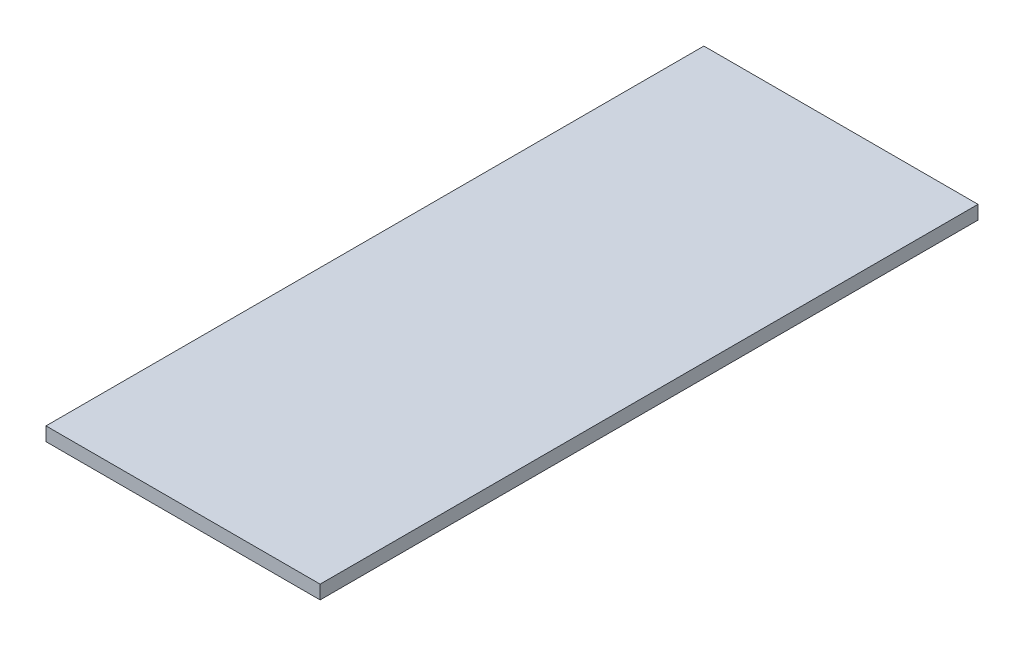
from build123d import *

# Parameters (mm, degrees)
SKETCH1_W           = 254
SKETCH1_H           = 609.6
BOSS_EXTRUDE1_DEPTH = 12.7


with BuildPart() as part:
    # Sketch1 → Boss-Extrude1 (new body)
    with BuildSketch(Plane(origin=(0, 0, 0), x_dir=(1, 0, 0), z_dir=(0, 1, 0))):
        with Locations((127, 304.8)):
            Rectangle(SKETCH1_W, SKETCH1_H)
    extrude(amount=BOSS_EXTRUDE1_DEPTH)


solid = part.part
